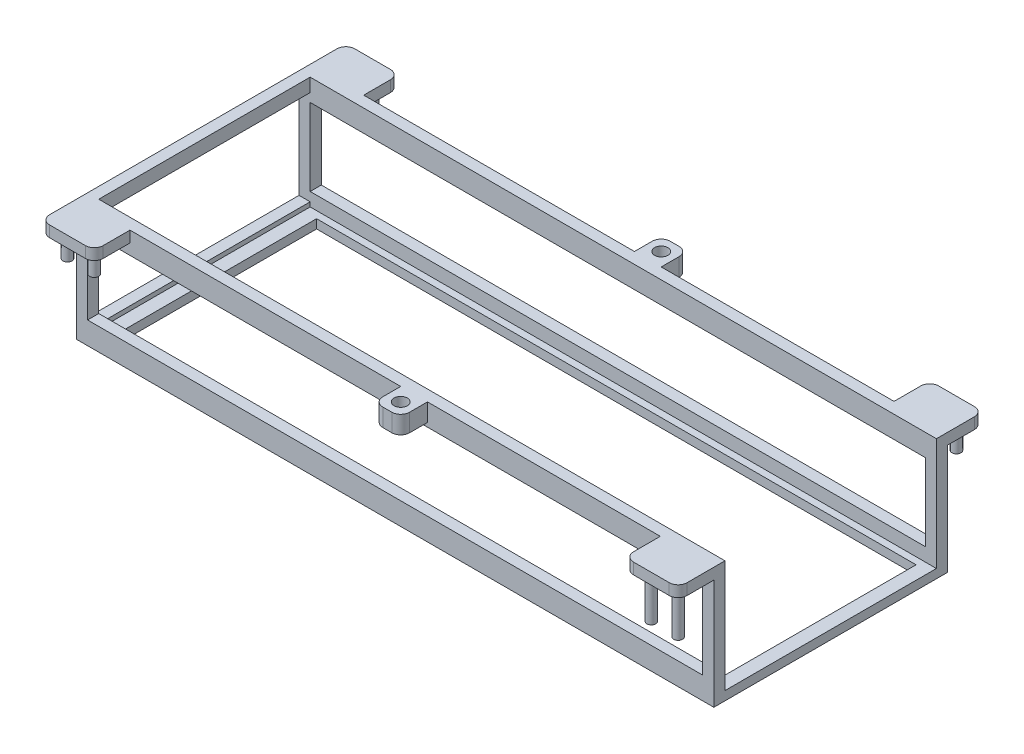
from build123d import *

# Parameters (mm, degrees)
SKETCH1_W            = 145.4
SKETCH1_H            = 52.4
BOSS_EXTRUDE1_DEPTH  = 27.2
SKETCH2_W            = 140.4
SKETCH2_H            = 47.4
CUT_EXTRUDE1_DEPTH   = 25.2
SKETCH3_W            = 46.4
SKETCH3_H            = 25.2
CUT_EXTRUDE2_DEPTH   = 25.2
SKETCH4_W            = 6
SKETCH4_H            = 6
BOSS_EXTRUDE2_DEPTH  = 4
FILLET1_R            = 2
FILLET2_R            = 2
SKETCH7_R            = 1.5
CUT_EXTRUDE4_DEPTH   = 4
SKETCH8_W            = 2.5
SKETCH8_H            = 52.4
CUT_EXTRUDE5_DEPTH   = 43
SKETCH9_W            = 47.4
SKETCH9_H            = 21.2
CUT_EXTRUDE6_DEPTH   = 43
SKETCH11_W           = 137.9
SKETCH11_H           = 17.288060203
CUT_EXTRUDE7_DEPTH   = 59
SKETCH12_W           = 134.4
SKETCH12_H           = 44.280487354
CUT_EXTRUDE8_DEPTH   = 10
SKETCH16_W           = 12
SKETCH16_H           = 2.5
BOSS_EXTRUDE4_DEPTH  = 8
FILLET3_R            = 2
SKETCH17_R           = 1
BOSS_EXTRUDE5_DEPTH  = 5
SKETCH18_W           = 12
SKETCH18_H           = 2.5
BOSS_EXTRUDE6_DEPTH  = 8
FILLET4_R            = 2
SKETCH19_R           = 1
BOSS_EXTRUDE7_DEPTH  = 10
SKETCH20_W           = 12
SKETCH20_H           = 2.5
BOSS_EXTRUDE8_DEPTH  = 8
FILLET5_R            = 2
SKETCH21_R           = 1
BOSS_EXTRUDE9_DEPTH  = 5
SKETCH22_W           = 12
SKETCH22_H           = 2.5
BOSS_EXTRUDE10_DEPTH = 8
FILLET6_R            = 2
SKETCH23_R           = 1
BOSS_EXTRUDE11_DEPTH = 5


with BuildPart() as part:
    # Sketch1 → Boss-Extrude1 (new body)
    with BuildSketch(Plane(origin=(0, 0, 0), x_dir=(1, 0, 0), z_dir=(0, 1, 0))):
        Rectangle(SKETCH1_W, SKETCH1_H)
    extrude(amount=BOSS_EXTRUDE1_DEPTH)

    # Sketch2 → Cut-Extrude1 (cut)
    with BuildSketch(Plane(origin=(0, 27.2, 0), x_dir=(1, 0, 0), z_dir=(0, 1, 0))):
        Rectangle(SKETCH2_W, SKETCH2_H)
    extrude(amount=-CUT_EXTRUDE1_DEPTH, mode=Mode.SUBTRACT)

    # Sketch3 → Cut-Extrude2 (cut)
    with BuildSketch(Plane.ZY.offset(-70.2)):
        with Locations((0.5, 14.6)):
            Rectangle(SKETCH3_W, SKETCH3_H)
    extrude(amount=-CUT_EXTRUDE2_DEPTH, mode=Mode.SUBTRACT)

    # Sketch4 → Boss-Extrude2 (add)
    with BuildSketch(Plane(origin=(0, 27.2, 0), x_dir=(1, 0, 0), z_dir=(0, 1, 0))):
        with Locations((3, -29.2)):
            Rectangle(SKETCH4_W, SKETCH4_H)
        with Locations((3, 29.2)):
            Rectangle(SKETCH4_W, SKETCH4_H)
    extrude(amount=-BOSS_EXTRUDE2_DEPTH)

    # Fillet1
    fillet1_edges = [part.edges().sort_by_distance(p)[0] for p in [
        (0, 25.2, -32.2),
        (6, 25.2, -32.2),
    ]]
    fillet(fillet1_edges, radius=FILLET1_R)

    # Fillet2
    fillet2_edges = [part.edges().sort_by_distance(p)[0] for p in [
        (0, 25.2, 32.2),
        (6, 25.2, 32.2),
    ]]
    fillet(fillet2_edges, radius=FILLET2_R)

    # Sketch7 → Cut-Extrude4 (cut)
    with BuildSketch(Plane(origin=(0, 23.2, 0), x_dir=(-1, 0, 0), z_dir=(0, -1, 0))):
        with Locations(Location((-3, -29.2, 0), (0, 0, 90))):
            Circle(SKETCH7_R)
        with Locations(Location((-3, 29.2, 0), (0, 0, 90))):
            Circle(SKETCH7_R)
    extrude(amount=-CUT_EXTRUDE4_DEPTH, mode=Mode.SUBTRACT)

    # Sketch8 → Cut-Extrude5 (cut)
    with BuildSketch(Plane(origin=(0, 27.2, 0), x_dir=(1, 0, 0), z_dir=(0, 1, 0))):
        with Locations((71.45, 0)):
            Rectangle(SKETCH8_W, SKETCH8_H)
    extrude(amount=-CUT_EXTRUDE5_DEPTH, mode=Mode.SUBTRACT)

    # Sketch9 → Cut-Extrude6 (cut)
    with BuildSketch(Plane.ZY.offset(72.7)):
        with Locations((0, 13.6)):
            Rectangle(SKETCH9_W, SKETCH9_H)
    extrude(amount=-CUT_EXTRUDE6_DEPTH, mode=Mode.SUBTRACT)

    # Sketch11 → Cut-Extrude7 (cut)
    with BuildSketch(Plane(origin=(0, 0, -26.2), x_dir=(-1, 0, 0), z_dir=(0, 0, -1))):
        with Locations((1.25, 13.644030102)):
            Rectangle(SKETCH11_W, SKETCH11_H)
    extrude(amount=-CUT_EXTRUDE7_DEPTH, mode=Mode.SUBTRACT)

    # Sketch12 → Cut-Extrude8 (cut)
    with BuildSketch(Plane(origin=(0, 0, 0), x_dir=(-1, 0, 0), z_dir=(0, -1, 0))):
        Rectangle(SKETCH12_W, SKETCH12_H)
    extrude(amount=-CUT_EXTRUDE8_DEPTH, mode=Mode.SUBTRACT)

    # Sketch16 → Boss-Extrude4 (add)
    with BuildSketch(Plane(origin=(0, 0, -26.2), x_dir=(-1, 0, 0), z_dir=(0, 0, -1))):
        with Locations((-64.2, 25.95)):
            Rectangle(SKETCH16_W, SKETCH16_H)
    extrude(amount=BOSS_EXTRUDE4_DEPTH)

    # Fillet3
    fillet3_edges = [part.edges().sort_by_distance(p)[0] for p in [
        (70.2, 25.95, -34.2),
        (58.2, 25.95, -34.2),
    ]]
    fillet(fillet3_edges, radius=FILLET3_R)

    # Sketch17 → Boss-Extrude5 (add)
    with BuildSketch(Plane(origin=(0, 24.7, 0), x_dir=(-1, 0, 0), z_dir=(0, -1, 0))):
        with Locations(Location((-67.2, 31.2, 0), (0, 0, 270))):
            Circle(SKETCH17_R)
        with Locations(Location((-61.2, 31.2, 0), (0, 0, 270))):
            Circle(SKETCH17_R)
    extrude(amount=BOSS_EXTRUDE5_DEPTH)

    # Sketch18 → Boss-Extrude6 (add)
    with BuildSketch(Plane.XY.offset(26.2)):
        with Locations((64.2, 25.95)):
            Rectangle(SKETCH18_W, SKETCH18_H)
    extrude(amount=BOSS_EXTRUDE6_DEPTH)

    # Fillet4
    fillet4_edges = [part.edges().sort_by_distance(p)[0] for p in [
        (70.2, 25.95, 34.2),
        (58.2, 25.95, 34.2),
    ]]
    fillet(fillet4_edges, radius=FILLET4_R)

    # Sketch19 → Boss-Extrude7 (add)
    with BuildSketch(Plane(origin=(0, 24.7, 0), x_dir=(-1, 0, 0), z_dir=(0, -1, 0))):
        with Locations(Location((-67.2, -31.2, 0), (0, 0, 270))):
            Circle(SKETCH19_R)
        with Locations(Location((-61.2, -31.2, 0), (0, 0, 270))):
            Circle(SKETCH19_R)
    extrude(amount=BOSS_EXTRUDE7_DEPTH)

    # Sketch20 → Boss-Extrude8 (add)
    with BuildSketch(Plane.XY.offset(26.2)):
        with Locations((-66.7, 25.95)):
            Rectangle(SKETCH20_W, SKETCH20_H)
    extrude(amount=BOSS_EXTRUDE8_DEPTH)

    # Fillet5
    fillet5_edges = [part.edges().sort_by_distance(p)[0] for p in [
        (-72.7, 25.95, 34.2),
        (-60.7, 25.95, 34.2),
    ]]
    fillet(fillet5_edges, radius=FILLET5_R)

    # Sketch21 → Boss-Extrude9 (add)
    with BuildSketch(Plane(origin=(0, 24.7, 0), x_dir=(-1, 0, 0), z_dir=(0, -1, 0))):
        with Locations(Location((63.7, -31.2, 0), (0, 0, 270))):
            Circle(SKETCH21_R)
        with Locations(Location((69.7, -31.2, 0), (0, 0, 270))):
            Circle(SKETCH21_R)
    extrude(amount=BOSS_EXTRUDE9_DEPTH)

    # Sketch22 → Boss-Extrude10 (add)
    with BuildSketch(Plane(origin=(0, 0, -26.2), x_dir=(-1, 0, 0), z_dir=(0, 0, -1))):
        with Locations((66.7, 25.95)):
            Rectangle(SKETCH22_W, SKETCH22_H)
    extrude(amount=BOSS_EXTRUDE10_DEPTH)

    # Fillet6
    fillet6_edges = [part.edges().sort_by_distance(p)[0] for p in [
        (-72.7, 25.95, -34.2),
        (-60.7, 25.95, -34.2),
    ]]
    fillet(fillet6_edges, radius=FILLET6_R)

    # Sketch23 → Boss-Extrude11 (add)
    with BuildSketch(Plane(origin=(0, 24.7, 0), x_dir=(-1, 0, 0), z_dir=(0, -1, 0))):
        with Locations(Location((63.7, 31.2, 0), (0, 0, 270))):
            Circle(SKETCH23_R)
        with Locations(Location((69.7, 31.2, 0), (0, 0, 270))):
            Circle(SKETCH23_R)
    extrude(amount=BOSS_EXTRUDE11_DEPTH)


solid = part.part
